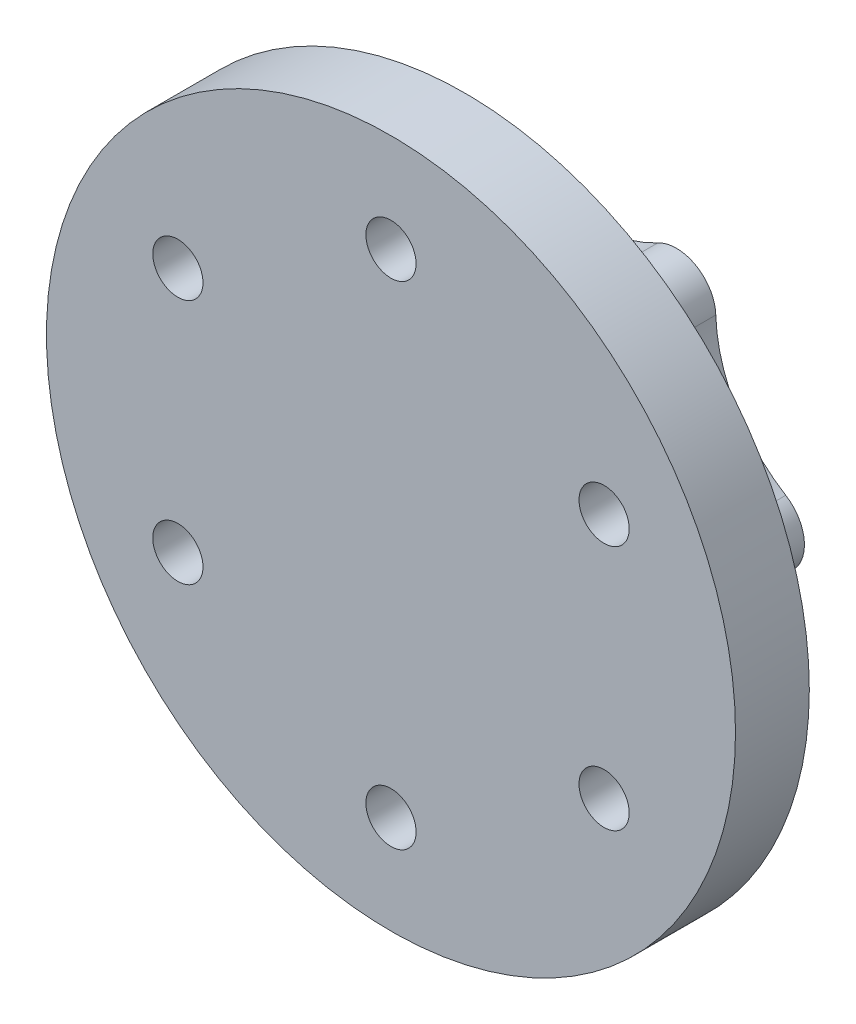
from build123d import *

# Parameters (mm, degrees)
BOSS_EXTRUDE1_DEPTH = 12.5
CUT_EXTRUDE1_START  = 12.5
SKETCH4_R           = 5
CUT_EXTRUDE1_DEPTH  = 9.3
BOSS_EXTRUDE2_START = 12.5
SKETCH6_R           = 35
BOSS_EXTRUDE2_DEPTH = 7.5
CUT_EXTRUDE5_START  = 20
SKETCH9_R           = 2.55
CUT_EXTRUDE5_DEPTH  = 12
SKETCH5_R           = 2.05
CUT_EXTRUDE6_DEPTH  = 10


with BuildPart() as part:
    # Sketch2 → Boss-Extrude1 (new body)
    with BuildSketch(Plane(origin=(0, 0, 0), x_dir=(0, 1, 0), z_dir=(0, 0, 1))):
        with BuildLine():
            ThreePointArc((3.402279768, 20.103447736), (0, 22), (-3.402279768, 20.103447736))
            ThreePointArc((-3.402279768, 20.103447736), (-7.622462843, 15.658643671), (-13.268220181, 13.272925238))
            ThreePointArc((-13.268220181, 13.272925238), (-14.482955544, 13.085514107), (-15.708956559, 12.998184578))
            ThreePointArc((-15.708956559, 12.998184578), (-19.052558883, 11), (-19.111236327, 7.105263158))
            ThreePointArc((-19.111236327, 7.105263158), (-17.775931243, 3.663582804), (-17.321657799, 0))
            ThreePointArc((-17.321657799, 0), (-17.775931243, -3.663582804), (-19.111236327, -7.105263158))
            ThreePointArc((-19.111236327, -7.105263158), (-19.052558883, -11), (-15.708956559, -12.998184578))
            ThreePointArc((-15.708956559, -12.998184578), (-14.482955544, -13.085514107), (-13.268220181, -13.272925238))
            ThreePointArc((-13.268220181, -13.272925238), (-7.622462843, -15.658643671), (-3.402279768, -20.103447736))
            ThreePointArc((-3.402279768, -20.103447736), (0, -22), (3.402279768, -20.103447736))
            ThreePointArc((3.402279768, -20.103447736), (7.622462843, -15.658643671), (13.268220181, -13.272925238))
            ThreePointArc((13.268220181, -13.272925238), (14.482955544, -13.085514107), (15.708956559, -12.998184578))
            ThreePointArc((15.708956559, -12.998184578), (19.052558883, -11), (19.111236327, -7.105263158))
            ThreePointArc((19.111236327, -7.105263158), (17.775931243, -3.663582804), (17.321657799, 0))
            ThreePointArc((17.321657799, 0), (17.775931243, 3.663582804), (19.111236327, 7.105263158))
            ThreePointArc((19.111236327, 7.105263158), (19.052558883, 11), (15.708956559, 12.998184578))
            ThreePointArc((15.708956559, 12.998184578), (9.749551787, 14.430568297), (4.860580348, 18.127078359))
            ThreePointArc((4.860580348, 18.127078359), (4.090909866, 19.085364477), (3.402279768, 20.103447736))
        make_face()
    extrude(amount=BOSS_EXTRUDE1_DEPTH)

    # Sketch4 → Cut-Extrude1 (cut)
    with BuildSketch(Plane(origin=(0, 0, 0), x_dir=(0, 1, 0), z_dir=(0, 0, 1)).offset(CUT_EXTRUDE1_START)):
        with Locations((-15.588457268, 9)):
            Circle(SKETCH4_R)
        with Locations((0, 18)):
            Circle(SKETCH4_R)
        with Locations((15.588457268, 9)):
            Circle(SKETCH4_R)
        with Locations((15.588457268, -9)):
            Circle(SKETCH4_R)
        with Locations((0, -18)):
            Circle(SKETCH4_R)
        with Locations((-15.588457268, -9)):
            Circle(SKETCH4_R)
    extrude(amount=-CUT_EXTRUDE1_DEPTH, mode=Mode.SUBTRACT)

    # Sketch6 → Boss-Extrude2 (add)
    with BuildSketch(Plane(origin=(0, 0, 0), x_dir=(0, 1, 0), z_dir=(0, 0, 1)).offset(BOSS_EXTRUDE2_START)):
        with Locations(Location((0, 0, 0), (0, 0, 270))):
            Circle(SKETCH6_R)
    extrude(amount=BOSS_EXTRUDE2_DEPTH)

    # Sketch9 → Cut-Extrude5 (cut)
    with BuildSketch(Plane(origin=(0, 0, 0), x_dir=(0, 1, 0), z_dir=(0, 0, 1)).offset(CUT_EXTRUDE5_START)):
        with Locations(Location((12.5, 21.650635095, 0), (0, 0, 270))):
            Circle(SKETCH9_R)
        with Locations(Location((25, 0, 0), (0, 0, 270))):
            Circle(SKETCH9_R)
        with Locations(Location((12.5, -21.650635095, 0), (0, 0, 270))):
            Circle(SKETCH9_R)
        with Locations(Location((-12.5, -21.650635095, 0), (0, 0, 270))):
            Circle(SKETCH9_R)
        with Locations(Location((-25, 0, 0), (0, 0, 270))):
            Circle(SKETCH9_R)
        with Locations(Location((-12.5, 21.650635095, 0), (0, 0, 270))):
            Circle(SKETCH9_R)
    extrude(amount=-CUT_EXTRUDE5_DEPTH, mode=Mode.SUBTRACT)

    # Sketch5 → Cut-Extrude6 (cut)
    with BuildSketch(Plane(origin=(0, 0, 0), x_dir=(0, 1, 0), z_dir=(0, 0, 1))):
        with Locations(Location((-15.588457268, 9, 0), (0, 0, 270))):
            Circle(SKETCH5_R)
        with Locations(Location((0, 18, 0), (0, 0, 270))):
            Circle(SKETCH5_R)
        with Locations(Location((15.588457268, 9, 0), (0, 0, 270))):
            Circle(SKETCH5_R)
        with Locations(Location((15.588457268, -9, 0), (0, 0, 270))):
            Circle(SKETCH5_R)
        with Locations(Location((0, -18, 0), (0, 0, 270))):
            Circle(SKETCH5_R)
        with Locations(Location((-15.588457268, -9, 0), (0, 0, 270))):
            Circle(SKETCH5_R)
    extrude(amount=CUT_EXTRUDE6_DEPTH, mode=Mode.SUBTRACT)


solid = part.part
